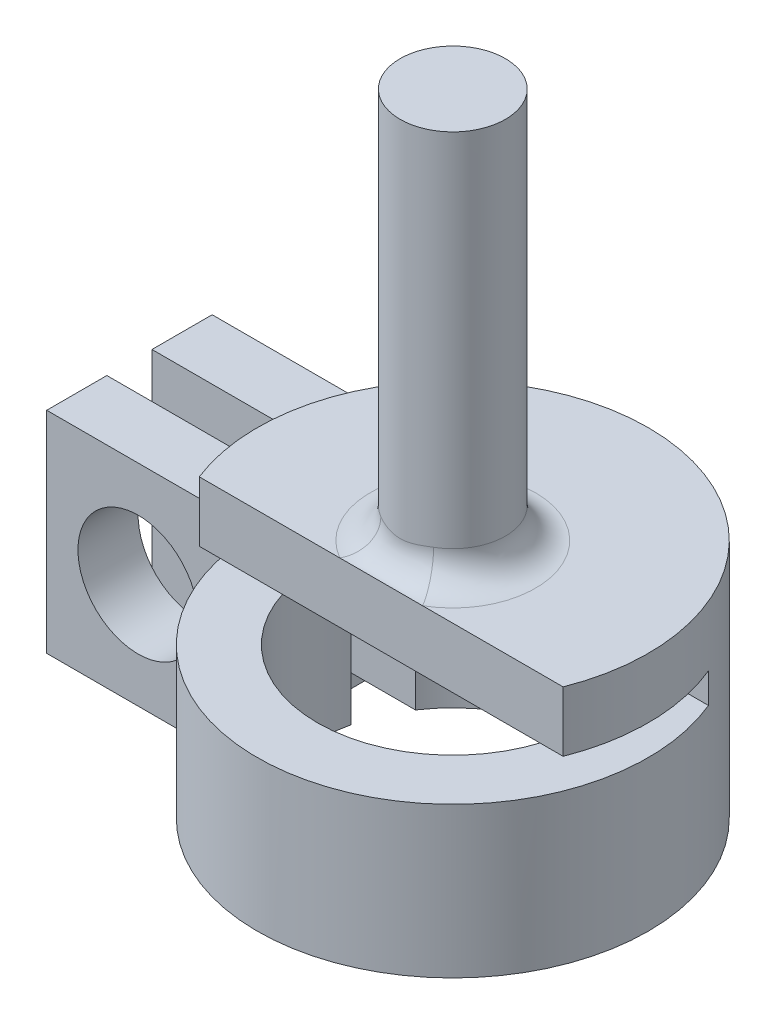
from build123d import *

# Parameters (mm, degrees)
BOSS_EXTRUDE1_DEPTH = 5
BOSS_EXTRUDE2_REACH = 17.411
SKETCH3_W           = 6.077383711
SKETCH3_H           = 1
SKETCH4_W           = 1.5
SKETCH4_H           = 7
CUT_EXTRUDE1_DEPTH  = 10
SKETCH2_R           = 2
CUT_EXTRUDE2_DEPTH  = 10
BOSS_EXTRUDE3_DEPTH = 1
BOSS_EXTRUDE4_DEPTH = 2
SKETCH7_R           = 1.75
BOSS_EXTRUDE5_DEPTH = 13
FILLET1_R           = 1


with BuildPart() as part:
    # Sketch1 → Boss-Extrude1 (new body)
    with BuildSketch(Plane(origin=(0, 0, 0), x_dir=(1, 0, 0), z_dir=(0, 1, 0))):
        with BuildLine():
            Line((-4.69041576, 4.5), (-12.5, 4.5))
            Line((-12.5, 4.5), (-12.5, 2.5))
            Line((-12.5, 2.5), (-3.741657387, 2.5))
            ThreePointArc((-3.741657387, 2.5), (4.133186129, -1.779542756), (-4.387482194, 1))
            Line((-4.387482194, 1), (-12.5, 1))
            Line((-12.5, 1), (-12.5, -1))
            Line((-12.5, -1), (-6.422616289, -1))
            ThreePointArc((-6.422616289, -1), (6.199787926, -1.952595623), (-4.69041576, 4.5))
        make_face()
    extrude(amount=BOSS_EXTRUDE1_DEPTH)

    # Boss-Extrude2: up to this face of the body (flat: up to its plane)
    boss_extrude2_end = Plane(part.part.faces().sort_by_distance((-8.59520788, 2.5, -4.5))[0])
    # Sketch3 → Boss-Extrude2 (add, up to the picked face)
    with BuildSketch(Plane.XY.offset(1), mode=Mode.PRIVATE) as boss_extrude2_sk1:
        with Locations((-9.461308145, 5.5)):
            Rectangle(SKETCH3_W, SKETCH3_H)
    boss_extrude2_tool1 = split(extrude(boss_extrude2_sk1.sketch, amount=-BOSS_EXTRUDE2_REACH, mode=Mode.PRIVATE), bisect_by=boss_extrude2_end, keep=Keep.BOTH, mode=Mode.PRIVATE)
    # Sketch3 → Boss-Extrude2 (add, up to the picked face)
    with BuildSketch(Plane.XY.offset(1), mode=Mode.PRIVATE) as boss_extrude2_sk2:
        with Locations((-9.461308145, -0.5)):
            Rectangle(SKETCH3_W, SKETCH3_H)
    boss_extrude2_tool2 = split(extrude(boss_extrude2_sk2.sketch, amount=-BOSS_EXTRUDE2_REACH, mode=Mode.PRIVATE), bisect_by=boss_extrude2_end, keep=Keep.BOTH, mode=Mode.PRIVATE)
    add(boss_extrude2_tool1.solids().sort_by(Axis((-9.461308, 5.5, 1), (0, 0, -1)))[0])
    add(boss_extrude2_tool2.solids().sort_by(Axis((-9.461308, -0.5, 1), (0, 0, -1)))[0])

    # Sketch4 → Cut-Extrude1 (cut)
    with BuildSketch(Plane.ZY.offset(12.5)):
        with Locations((-1.75, 2.5)):
            Rectangle(SKETCH4_W, SKETCH4_H)
    extrude(amount=-CUT_EXTRUDE1_DEPTH, mode=Mode.SUBTRACT)

    # Sketch2 → Cut-Extrude2 (cut)
    with BuildSketch(Plane.XY.offset(1)):
        with Locations((-9.461308145, 2.5)):
            Circle(SKETCH2_R)
    extrude(amount=-CUT_EXTRUDE2_DEPTH, mode=Mode.SUBTRACT)

    # Sketch5 → Boss-Extrude3 (add)
    with BuildSketch(Plane(origin=(0, 5, 0), x_dir=(1, 0, 0), z_dir=(0, 1, 0))):
        with BuildLine():
            Line((4.898979486, 2.5), (6, 2.5))
            ThreePointArc((6, 2.5), (0, 6.5), (-6, 2.5))
            Line((-6, 2.5), (-4.898979486, 2.5))
            ThreePointArc((-4.898979486, 2.5), (0, 5.5), (4.898979486, 2.5))
        make_face()
    extrude(amount=BOSS_EXTRUDE3_DEPTH)

    # Sketch6 → Boss-Extrude4 (add)
    with BuildSketch(Plane(origin=(0, 6, 0), x_dir=(1, 0, 0), z_dir=(0, 1, 0))):
        with BuildLine():
            Line((-6.048440472, -2.380413381), (6.048440472, -2.380413381))
            ThreePointArc((6.048440472, -2.380413381), (0, 6.5), (-6.048440472, -2.380413381))
        make_face()
    extrude(amount=BOSS_EXTRUDE4_DEPTH)

    # Sketch7 → Boss-Extrude5 (add)
    with BuildSketch(Plane(origin=(0, 8, 0), x_dir=(1, 0, 0), z_dir=(0, 1, 0))):
        with Locations(Location((0, 0, 0), (0, 0, 90))):
            Circle(SKETCH7_R)
    extrude(amount=BOSS_EXTRUDE5_DEPTH)

    # Fillet1
    fillet1_edges = [part.edges().sort_by_distance(p)[0] for p in [
        (0, 8, 1.75),
    ]]
    fillet(fillet1_edges, radius=FILLET1_R)


solid = part.part
